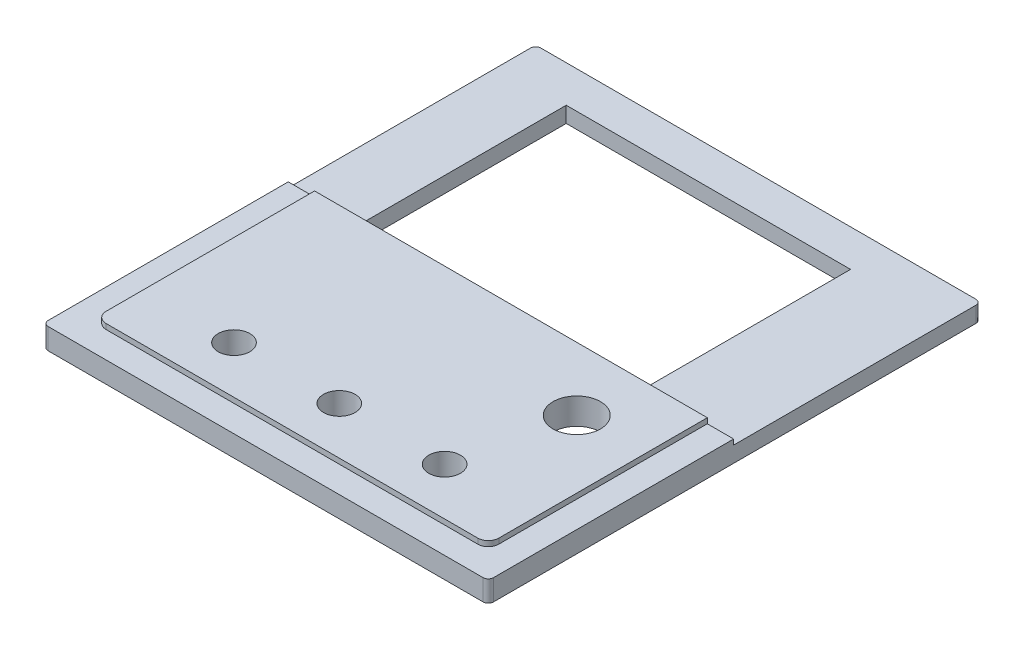
from build123d import *

# Parameters (mm, degrees)
SKETCH_1_W          = 74.6
SKETCH_1_H          = 83.6
EXTRUDE_1_DEPTH     = 1
FILLET_1_R          = 2
SKETCH_2_W          = 84.6
SKETCH_2_H          = 93.6
EXTRUDE_2_DEPTH     = 4
FILLET_2_R          = 1
SKETCH_3_R          = 3
SKETCH_3_R_2        = 4.5
SKETCH_3_W          = 54
SKETCH_3_H          = 38
CUT_EXTRUDE_1_DEPTH = 64.281355864
SKETCH_4_W          = 84.6
SKETCH_4_H          = 47
CUT_EXTRUDE_2_DEPTH = 2
SKETCH_5_W          = 2.5
SKETCH_5_H          = 1.5
SKETCH_5_W_2        = 3
SKETCH_5_H_2        = 2
CUT_EXTRUDE_3_DEPTH = 3.6


with BuildPart() as part:
    # Эскиз1 → Бобышка-Вытянуть1 (new body)
    with BuildSketch(Plane(origin=(0, 0, 0), x_dir=(1, 0, 0), z_dir=(0, 1, 0))):
        Rectangle(SKETCH_1_W, SKETCH_1_H)
    extrude(amount=EXTRUDE_1_DEPTH)

    # Скругление1
    fillet_1_edges = [part.edges().sort_by_distance(p)[0] for p in [
        (37.3, 0.5, 41.8),
        (-37.3, 0.5, 41.8),
        (-37.3, 0.5, -41.8),
        (37.3, 0.5, -41.8),
    ]]
    fillet(fillet_1_edges, radius=FILLET_1_R)

    # Эскиз2 → Бобышка-Вытянуть2 (add)
    with BuildSketch(Plane.XZ):
        Rectangle(SKETCH_2_W, SKETCH_2_H)
    extrude(amount=EXTRUDE_2_DEPTH)

    # Скругление2
    fillet_2_edges = [part.edges().sort_by_distance(p)[0] for p in [
        (-42.3, -2, 46.8),
        (-42.3, -2, -46.8),
        (42.3, -2, -46.8),
        (42.3, -2, 46.8),
    ]]
    fillet(fillet_2_edges, radius=FILLET_2_R)

    # Эскиз3 → Вырез-Вытянуть1 (cut, through all)
    with BuildSketch(Plane(origin=(0, 1, 0), x_dir=(1, 0, 0), z_dir=(0, 1, 0))):
        with Locations(Location((-20, -32.8, 0), (0, 0, 270))):
            Circle(SKETCH_3_R)
        with Locations(Location((0, -32.8, 0), (0, 0, 270))):
            Circle(SKETCH_3_R)
        with Locations(Location((20, -32.8, 0), (0, 0, 270))):
            Circle(SKETCH_3_R)
        with Locations(Location((24.5, -12.2, 0), (0, 0, 270))):
            Circle(SKETCH_3_R_2)
        with Locations((-2.5, 20.8)):
            Rectangle(SKETCH_3_W, SKETCH_3_H)
    extrude(amount=-CUT_EXTRUDE_1_DEPTH, mode=Mode.SUBTRACT)

    # Эскиз4 → Вырез-Вытянуть2 (cut)
    with BuildSketch(Plane(origin=(0, 1, 0), x_dir=(1, 0, 0), z_dir=(0, 1, 0))):
        with Locations((0, 23.3)):
            Rectangle(SKETCH_4_W, SKETCH_4_H)
    extrude(amount=-CUT_EXTRUDE_2_DEPTH, mode=Mode.SUBTRACT)

    # Эскиз5 → Вырез-Вытянуть3 (cut)
    with BuildSketch(Plane.XZ.offset(4)):
        with Locations((-20, 39.418347297)):
            Rectangle(SKETCH_5_W, SKETCH_5_H)
        with Locations((0, 39.418347297)):
            Rectangle(SKETCH_5_W, SKETCH_5_H)
        with Locations((20, 39.418347297)):
            Rectangle(SKETCH_5_W, SKETCH_5_H)
        with Locations((24.5, 21.7)):
            Rectangle(SKETCH_5_W_2, SKETCH_5_H_2)
    extrude(amount=-CUT_EXTRUDE_3_DEPTH, mode=Mode.SUBTRACT)


solid = part.part
